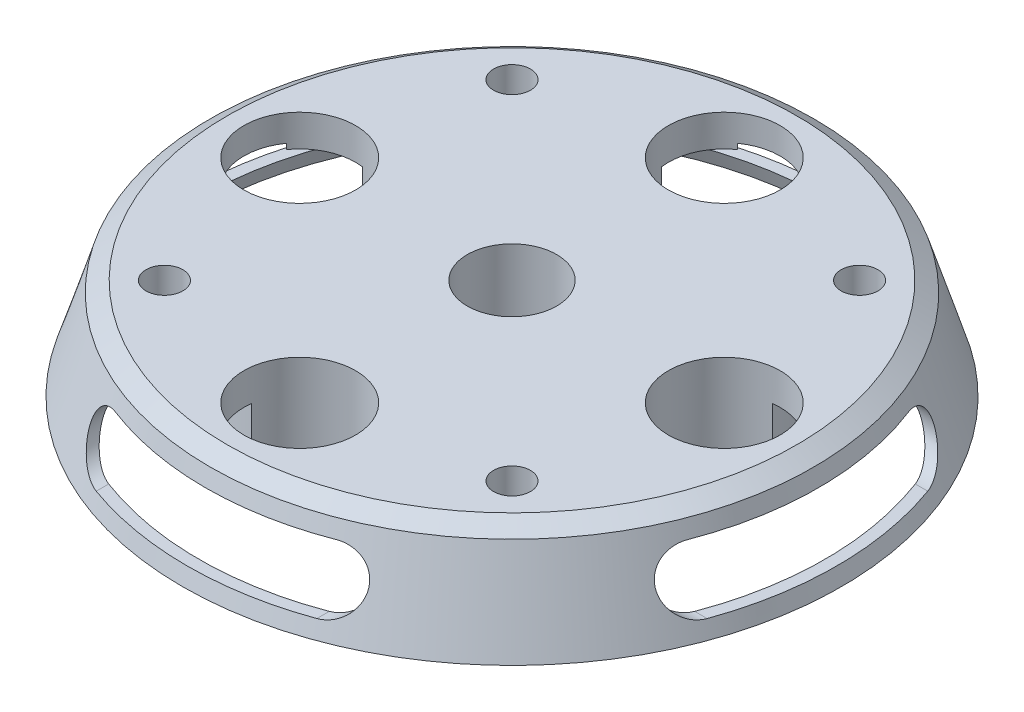
from build123d import *

# Parameters (mm, degrees)
SKETCH2_R             = 19
BOSS_EXTRUDE1_DEPTH   = 5
SKETCH3_R             = 5
CUT_EXTRUDE1_DEPTH    = 43.679034666
SKETCH4_R             = 4
CUT_EXTRUDE2_DEPTH    = 43.679034666
M4X0_7_TAPPED_HOLE1_D = 3.3
CUT_EXTRUDE3_DEPTH    = 6.43
CIRPATTERN1_COUNT     = 4


with BuildPart() as part:
    # Sketch1 → Revolve1 (revolve)
    with BuildSketch(Plane(origin=(0, 0, 0), x_dir=(0, 0, -1), z_dir=(1, 0, 0)), mode=Mode.PRIVATE) as revolve1_sk:
        Polygon((0, 9), (0, 6.15), (26.545687362, 6.15), (28.453012328, 0), (29.5, 0), (27.011788484, 8.023017104), (25.5, 9), align=None)
    revolve(revolve1_sk.sketch.rotate(Axis((0, 9, 0), (0, -1, 0)), 180), axis=Axis((0, 9, 0), (0, -1, 0)))

    # Sketch2 → Boss-Extrude1 (add)
    with BuildSketch(Plane.XZ.offset(-6.15)):
        with Locations(Location((0, 0, 0), (0, 0, 90))):
            Circle(SKETCH2_R)
    extrude(amount=BOSS_EXTRUDE1_DEPTH)

    # Sketch3 → Cut-Extrude1 (cut, through all)
    with BuildSketch(Plane(origin=(0, 9, 0), x_dir=(1, 0, 0), z_dir=(0, 1, 0))):
        with Locations(Location((0, 19, 0), (0, 0, 270))):
            Circle(SKETCH3_R)
        with Locations(Location((19, 0, 0), (0, 0, 270))):
            Circle(SKETCH3_R)
        with Locations(Location((0, -19, 0), (0, 0, 270))):
            Circle(SKETCH3_R)
        with Locations(Location((-19, 0, 0), (0, 0, 270))):
            Circle(SKETCH3_R)
    extrude(amount=-CUT_EXTRUDE1_DEPTH, mode=Mode.SUBTRACT)

    # Sketch4 → Cut-Extrude2 (cut, through all)
    with BuildSketch(Plane(origin=(0, 9, 0), x_dir=(1, 0, 0), z_dir=(0, 1, 0))):
        with Locations(Location((0, 0, 0), (0, 0, 270))):
            Circle(SKETCH4_R)
    extrude(amount=-CUT_EXTRUDE2_DEPTH, mode=Mode.SUBTRACT)

    # M4x0.7 Tapped Hole1 (through all)
    with Locations(Plane(origin=(0, 9, 0), x_dir=(1, 0, 0), z_dir=(0, 1, 0))):
        with Locations((-15.556349186, 15.556349186), (15.556349186, 15.556349186), (15.556349186, -15.556349186), (-15.556349186, -15.556349186)):
            Hole(M4X0_7_TAPPED_HOLE1_D / 2)

    # Sketch9 → Cut-Extrude3 (cut)
    with BuildSketch(Plane.XY.offset(-29.5)):
        with BuildLine():
            Line((-9.875, 6.636508552), (9.875, 6.636508552))
            ThreePointArc((9.875, 6.636508552), (12.5, 4.011508552), (9.875, 1.386508552))
            Line((9.875, 1.386508552), (-9.875, 1.386508552))
            ThreePointArc((-9.875, 1.386508552), (-12.5, 4.011508552), (-9.875, 6.636508552))
        make_face()
    cut_extrude3 = extrude(amount=CUT_EXTRUDE3_DEPTH, mode=Mode.SUBTRACT)

    # CirPattern1: Cut-Extrude3 ×4 about axis
    cirpattern1_axis = Axis((0, 0, 0), (0, 1, 0))
    for i in range(1, CIRPATTERN1_COUNT):
        add(cut_extrude3.rotate(cirpattern1_axis, i * 360 / CIRPATTERN1_COUNT), mode=Mode.SUBTRACT)


solid = part.part
